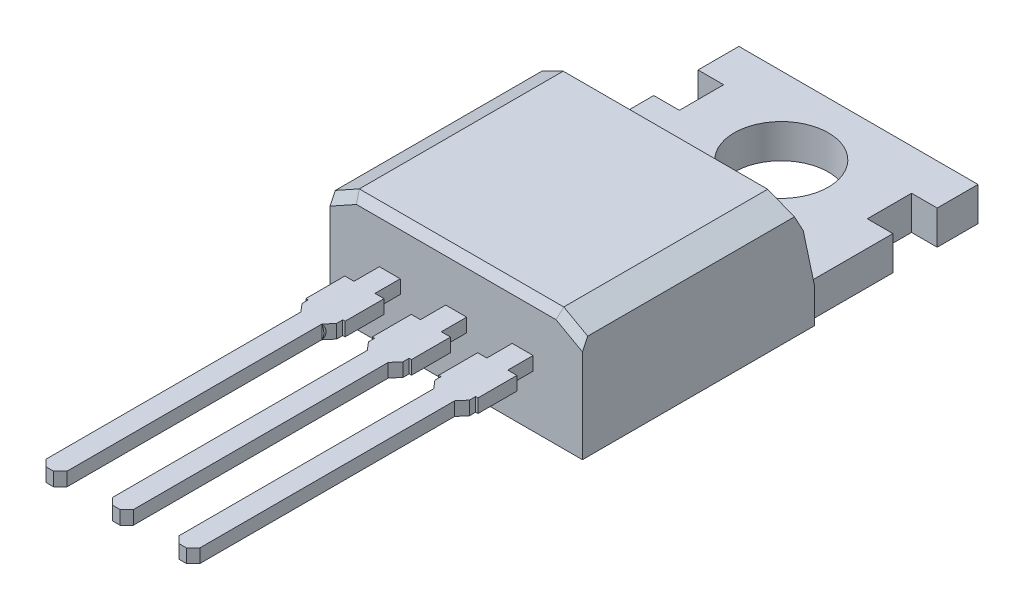
from build123d import *
from OCP.BRepFilletAPI import BRepFilletAPI_MakeChamfer

# Parameters (mm, degrees)
EXTRUDE1_DEPTH      = 4.826
EXTRUDE1_DEPTH_BACK = 4.826
SKETCH10_R          = 1.8
SKETCH10_W          = 1.233836604
SKETCH10_H          = 1.6931216
EXTRUDE5_DEPTH      = 16.428369203
SKETCH6_W           = 0.8
SKETCH6_H           = 0.52
EXTRUDE6_DEPTH      = 13
EXTRUDE7_START      = -0.52
EXTRUDE7_DEPTH      = 0.52
CHAMFER1_SIZE       = 0.254
SKETCH12_W          = 7.379682426
SKETCH12_H          = 2.736118788
EXTRUDE8_DEPTH      = 0.254
SKETCH13_W          = 7.379682426
SKETCH13_H          = 2.736118788
EXTRUDE9_DEPTH      = 0.254
CHAMFER2_SIZE       = 0.508
CHAMFER2_SIZE2      = 0.91645626
CHAMFER3_SIZE       = 0.2032
CHAMFER3_SIZE2      = 0.366582504
CHAMFER3_SIZE2_2    = 0.605677555
CHAMFER3_SIZE2_3    = 0.557834937
EXTRUDE10_DEPTH     = 1.016


with BuildPart() as part:
    # Sketch2 → Extrude1 (new, two sides: drawn at the far end of the back side and taken through both)
    with BuildSketch(Plane(origin=(0, 0, 0), x_dir=(0, 0, -1), z_dir=(1, 0, 0)).offset(-EXTRUDE1_DEPTH_BACK)):
        Polygon((14.3005, 0), (-1.0795, 0), (-1.0795, 4.5), (7.124012877, 4.5), (7.8005, 1.3), (14.3005, 1.3), align=None)
    extrude(amount=EXTRUDE1_DEPTH + EXTRUDE1_DEPTH_BACK)

    # Sketch10 → Extrude5 (cut, through all)
    with BuildSketch(Plane(origin=(0, 1.3, 0), x_dir=(1, 0, 0), z_dir=(0, 1, 0))):
        with Locations(Location((0, 11.3505, 0), (0, 0, 270))):
            Circle(SKETCH10_R)
        with Locations((-4.209081698, 11.892729701)):
            Rectangle(SKETCH10_W, SKETCH10_H)
        with Locations((4.209081698, 11.892729701)):
            Rectangle(SKETCH10_W, SKETCH10_H)
    extrude(amount=-EXTRUDE5_DEPTH, mode=Mode.SUBTRACT)

    # Sketch6 → Extrude6 (add)
    with BuildSketch(Plane.XY.offset(1.0795)):
        with Locations((2.54, 2.25)):
            Rectangle(SKETCH6_W, SKETCH6_H)
        with Locations((-2.54, 2.25)):
            Rectangle(SKETCH6_W, SKETCH6_H)
        with Locations((0, 2.25)):
            Rectangle(SKETCH6_W, SKETCH6_H)
    extrude(amount=EXTRUDE6_DEPTH)

    # Sketch11 → Extrude7 (add)
    with BuildSketch(Plane(origin=(0, 2.51, 0), x_dir=(1, 0, 0), z_dir=(0, 1, 0)).offset(EXTRUDE7_START)):
        Polygon((-2.94, -2.0475), (-3.29, -2.0475), (-3.29, -3.5395), (-3.2004, -3.5395), (-3.2004, -3.7747), (-2.94, -4.0795), align=None)
        Polygon((-1.79, -2.0475), (-2.14, -2.0475), (-2.14, -4.0795), (-1.8796, -3.7747), (-1.8796, -3.5395), (-1.79, -3.5395), align=None)
        Polygon((-0.4, -2.0475), (-0.75, -2.0475), (-0.75, -3.5395), (-0.6604, -3.5395), (-0.6604, -3.7747), (-0.4, -4.0795), align=None)
        Polygon((0.75, -2.0475), (0.4, -2.0475), (0.4, -4.0795), (0.6604, -3.7747), (0.6604, -3.5395), (0.75, -3.5395), align=None)
        Polygon((2.14, -2.0475), (1.79, -2.0475), (1.79, -3.5395), (1.8796, -3.5395), (1.8796, -3.7747), (2.14, -4.0795), align=None)
        Polygon((3.29, -2.0475), (2.94, -2.0475), (2.94, -4.0795), (3.2004, -3.7747), (3.2004, -3.5395), (3.29, -3.5395), align=None)
    extrude(amount=EXTRUDE7_DEPTH)

    # Chamfer1
    chamfer1_edges = [part.edges().sort_by_distance(p)[0] for p in [
        (-2.14, 2.25, 14.0795),
        (-2.94, 2.25, 14.0795),
        (2.94, 2.25, 14.0795),
        (2.14, 2.25, 14.0795),
        (0.4, 2.25, 14.0795),
        (-0.4, 2.25, 14.0795),
    ]]
    chamfer(chamfer1_edges, length=CHAMFER1_SIZE)

    # Sketch12 → Extrude8 (cut)
    with BuildSketch(Plane.ZY.offset(4.826)):
        with Locations((-11.490341213, 1.368059394)):
            Rectangle(SKETCH12_W, SKETCH12_H)
    extrude(amount=-EXTRUDE8_DEPTH, mode=Mode.SUBTRACT)

    # Sketch13 → Extrude9 (cut)
    with BuildSketch(Plane(origin=(4.826, 0, 0), x_dir=(0, 0, -1), z_dir=(1, 0, 0))):
        with Locations((11.490341213, 1.368059394)):
            Rectangle(SKETCH13_W, SKETCH13_H)
    extrude(amount=-EXTRUDE9_DEPTH, mode=Mode.SUBTRACT)

    # Chamfer2: one chamfer whose edges measure the first distance from different faces: ONE call of the kernel's chamfer builder (chamfer() names one face for all edges)
    chamfer2_edges_1 = [part.edges().sort_by_distance(p)[0] for p in [
        (-4.826, 4.5, -3.022256439),
    ]]
    chamfer2_side_1 = [part.faces().sort_by_distance(p)[0] for p in [
        (-4.826, 2.217055195, -3.243165334),
    ]]
    chamfer2_edges_2 = [part.edges().sort_by_distance(p)[0] for p in [
        (4.826, 4.5, -3.022256439),
    ]]
    chamfer2_side_2 = [part.faces().sort_by_distance(p)[0] for p in [
        (4.826, 2.217055195, -3.243165334),
    ]]
    chamfer2 = BRepFilletAPI_MakeChamfer(part.part.solid().wrapped)
    for e in chamfer2_edges_1:
        chamfer2.Add(CHAMFER2_SIZE, CHAMFER2_SIZE2, e.wrapped, chamfer2_side_1[0].wrapped)  # the first distance lies on this face
    for e in chamfer2_edges_2:
        chamfer2.Add(CHAMFER2_SIZE, CHAMFER2_SIZE2, e.wrapped, chamfer2_side_2[0].wrapped)  # the first distance lies on this face
    add(Compound.cast(chamfer2.Shape()), mode=Mode.REPLACE)

    # Chamfer3: one chamfer whose edges measure the first distance from different faces: ONE call of the kernel's chamfer builder (chamfer() names one face for all edges)
    chamfer3_edges_1 = [part.edges().sort_by_distance(p)[0] for p in [
        (0, 4.5, 1.0795),
    ]]
    chamfer3_side_1 = [part.faces().sort_by_distance(p)[0] for p in [
        (0, 4.5, -3.022256439),
    ]]
    chamfer3_edges_2 = [part.edges().sort_by_distance(p)[0] for p in [
        (-4.36777187, 4.246, 1.0795),
    ]]
    chamfer3_side_2 = [part.faces().sort_by_distance(p)[0] for p in [
        (-4.368765147, 4.245449417, -3.049162718),
    ]]
    chamfer3_edges_3 = [part.edges().sort_by_distance(p)[0] for p in [
        (4.36777187, 4.246, 1.0795),
    ]]
    chamfer3_side_3 = [part.faces().sort_by_distance(p)[0] for p in [
        (4.368765147, 4.245449417, -3.049162718),
    ]]
    chamfer3_edges_4 = [part.edges().sort_by_distance(p)[0] for p in [
        (0, 4.5, -7.124012877),
    ]]
    chamfer3_side_4 = [part.faces().sort_by_distance(p)[0] for p in [
        (0, 4.5, -3.022256439),
    ]]
    chamfer3_edges_5 = [part.edges().sort_by_distance(p)[0] for p in [
        (-4.36777187, 4.246, -7.177709043),
    ]]
    chamfer3_side_5 = [part.faces().sort_by_distance(p)[0] for p in [
        (-4.368765147, 4.245449417, -3.049162718),
    ]]
    chamfer3_edges_6 = [part.edges().sort_by_distance(p)[0] for p in [
        (4.36777187, 4.246, -7.177709043),
    ]]
    chamfer3_side_6 = [part.faces().sort_by_distance(p)[0] for p in [
        (4.368765147, 4.245449417, -3.049162718),
    ]]
    chamfer3 = BRepFilletAPI_MakeChamfer(part.part.solid().wrapped)
    for e in chamfer3_edges_1:
        chamfer3.Add(CHAMFER3_SIZE, CHAMFER3_SIZE2, e.wrapped, chamfer3_side_1[0].wrapped)  # the first distance lies on this face
    for e in chamfer3_edges_2:
        chamfer3.Add(CHAMFER3_SIZE, CHAMFER3_SIZE2, e.wrapped, chamfer3_side_2[0].wrapped)  # the first distance lies on this face
    for e in chamfer3_edges_3:
        chamfer3.Add(CHAMFER3_SIZE, CHAMFER3_SIZE2, e.wrapped, chamfer3_side_3[0].wrapped)  # the first distance lies on this face
    for e in chamfer3_edges_4:
        chamfer3.Add(CHAMFER3_SIZE, CHAMFER3_SIZE2_2, e.wrapped, chamfer3_side_4[0].wrapped)  # the first distance lies on this face
    for e in chamfer3_edges_5:
        chamfer3.Add(CHAMFER3_SIZE, CHAMFER3_SIZE2_3, e.wrapped, chamfer3_side_5[0].wrapped)  # the first distance lies on this face
    for e in chamfer3_edges_6:
        chamfer3.Add(CHAMFER3_SIZE, CHAMFER3_SIZE2_3, e.wrapped, chamfer3_side_6[0].wrapped)  # the first distance lies on this face
    add(Compound.cast(chamfer3.Shape()), mode=Mode.REPLACE)

    # Sketch15 → Extrude10 (add)
    with BuildSketch(Plane.XY.offset(4.0795)):
        with BuildLine():
            Line((-2.14, 2.51), (-2.94, 2.51))
            ThreePointArc((-2.94, 2.51), (-3.017074418, 2.25), (-2.94, 1.99))
            Line((-2.94, 1.99), (-2.14, 1.99))
            ThreePointArc((-2.14, 1.99), (-2.062925582, 2.25), (-2.14, 2.51))
        make_face()
    extrude(amount=-EXTRUDE10_DEPTH)


solid = part.part
